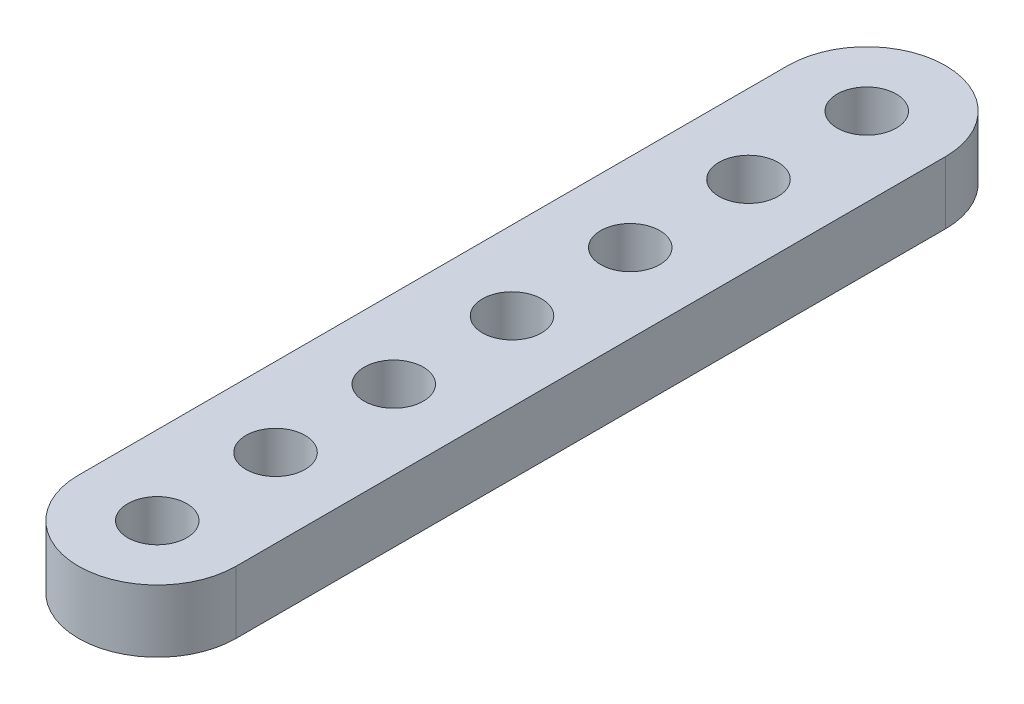
from build123d import *

# Parameters (mm, degrees)
SKETCH1_R           = 1.5
BOSS_EXTRUDE1_DEPTH = 3.175


with BuildPart() as part:
    # Sketch1 → Boss-Extrude1 (new body)
    with BuildSketch(Plane(origin=(0, 0, 0), x_dir=(1, 0, 0), z_dir=(0, 1, 0))):
        with BuildLine():
            Line((0, 0), (0, 36))
            ThreePointArc((0, 36), (4, 40), (8, 36))
            Line((8, 36), (8, 0))
            ThreePointArc((8, 0), (4, -4), (0, 0))
        make_face()
        with Locations(Location((4, 6, 0), (0, 0, 270))):
            Circle(SKETCH1_R, mode=Mode.SUBTRACT)
        with Locations(Location((4, 0, 0), (0, 0, 270))):
            Circle(SKETCH1_R, mode=Mode.SUBTRACT)
        with Locations(Location((4, 12, 0), (0, 0, 270))):
            Circle(SKETCH1_R, mode=Mode.SUBTRACT)
        with Locations(Location((4, 18, 0), (0, 0, 270))):
            Circle(SKETCH1_R, mode=Mode.SUBTRACT)
        with Locations(Location((4, 24, 0), (0, 0, 270))):
            Circle(SKETCH1_R, mode=Mode.SUBTRACT)
        with Locations(Location((4, 30, 0), (0, 0, 270))):
            Circle(SKETCH1_R, mode=Mode.SUBTRACT)
        with Locations(Location((4, 36, 0), (0, 0, 270))):
            Circle(SKETCH1_R, mode=Mode.SUBTRACT)
    extrude(amount=BOSS_EXTRUDE1_DEPTH)


solid = part.part
